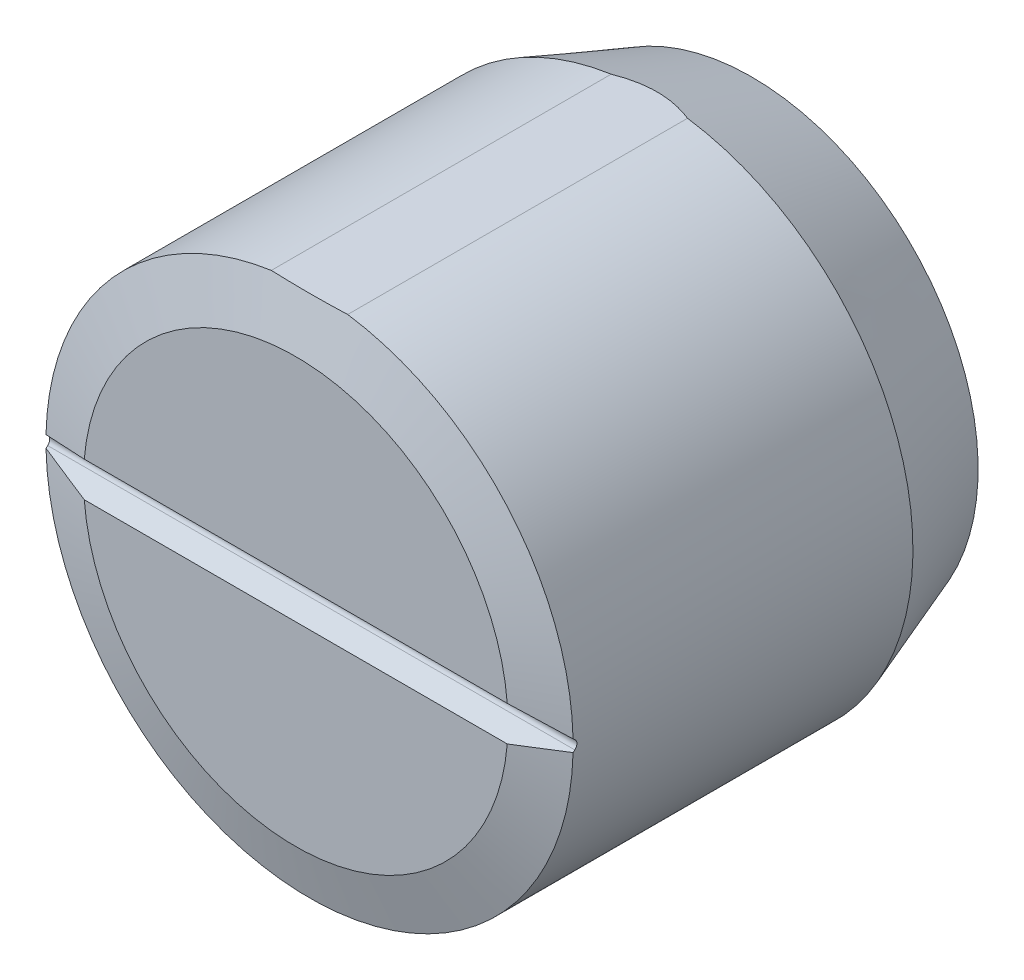
from build123d import *

# Parameters (mm, degrees)
EXTRUDE2_DEPTH      = 21.122535874
EXTRUDE2_DEPTH_BACK = 21.122535874
SKETCH3_W           = 7.52868736
SKETCH3_H           = 2
EXTRUDE3_DEPTH      = 21.122535963


with BuildPart() as part:
    # Sketch1 → Revolve1 (revolve)
    with BuildSketch(Plane(origin=(0, 0, 0), x_dir=(0, 0, -1), z_dir=(1, 0, 0)), mode=Mode.PRIVATE) as revolve1_sk:
        Polygon((0, 0), (0, 7.73110418), (-3.5, 9.005), (-15.109749167, 9.005), (-15.58, 7.25), (-15.58, 0), align=None)
    revolve(revolve1_sk.sketch.rotate(Axis((0, 0, 0), (0, 0, 1)), 90), axis=Axis((0, 0, 0), (0, 0, 1)))

    # Sketch2 → Extrude2 (cut, two sides: drawn at the far end of the back side and taken through both)
    with BuildSketch(Plane(origin=(0, 0, 0), x_dir=(0, -1, 0), z_dir=(1, 0, 0)).offset(-EXTRUDE2_DEPTH_BACK)):
        with BuildLine():
            Line((-0.152741588, -15.050887618), (-0.6, -15.58))
            Line((-0.6, -15.58), (0.6, -15.58))
            Line((0.6, -15.58), (0.152741588, -15.050887618))
            ThreePointArc((0.152741588, -15.050887618), (0, -14.98), (-0.152741588, -15.050887618))
        make_face()
    extrude(amount=EXTRUDE2_DEPTH + EXTRUDE2_DEPTH_BACK, mode=Mode.SUBTRACT)

    # Sketch3 → Extrude3 (cut, through all)
    with BuildSketch(Plane.XY.offset(15.58)):
        with Locations((0, 9.91)):
            Rectangle(SKETCH3_W, SKETCH3_H)
    extrude(amount=-EXTRUDE3_DEPTH, mode=Mode.SUBTRACT)


solid = part.part
